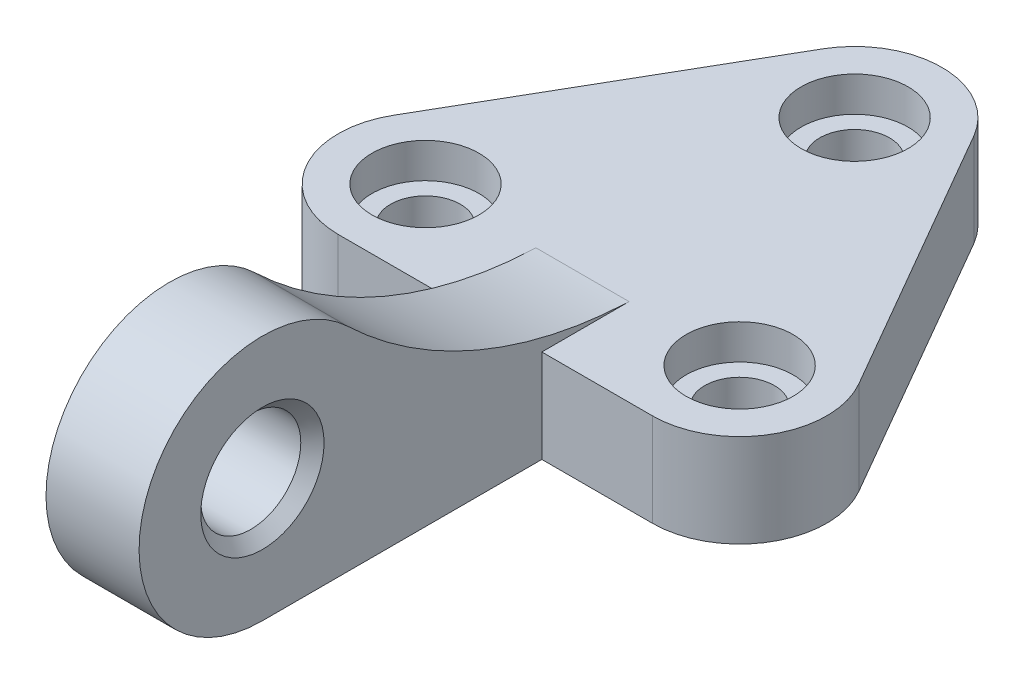
from build123d import *

# Parameters (mm, degrees)
BOSS_EXTRUDE1_DEPTH                             = 40
SKETCH4_R                                       = 23
CUT_EXTRUDE1_DEPTH                              = 15
BOSS_EXTRUDE3_DEPTH                             = 20
CSK_FOR_M2_OVAL_HEAD_MACHINE_SCREW1_D           = 43
CSK_FOR_M2_OVAL_HEAD_MACHINE_SCREW1_CSINK_D     = 53
CSK_FOR_M2_OVAL_HEAD_MACHINE_SCREW1_CSINK_ANGLE = 90
SKETCH18_W                                      = 15
SKETCH18_H                                      = 25
M2_CLEARANCE_HOLE1_AT_2_COUNT                   = 2
M2_CLEARANCE_HOLE1_AT_2_PITCH                   = 135
M2_CLEARANCE_HOLE1_AT_3_COUNT                   = 2
M2_CLEARANCE_HOLE1_AT_3_PITCH                   = 135


with BuildPart() as part:
    # Sketch1 → Boss-Extrude1 (new body)
    with BuildSketch(Plane(origin=(0, 0, 0), x_dir=(1, 0, 0), z_dir=(0, 1, 0))):
        with BuildLine():
            Line((64.951905284, 0), (199.951905284, 0))
            ThreePointArc((199.951905284, 0), (232.427857926, 18.75), (232.427857926, 56.25))
            Line((232.427857926, 56.25), (164.927857926, 173.163429511))
            ThreePointArc((164.927857926, 173.163429511), (132.451905284, 191.913429511), (99.975952642, 173.163429511))
            Line((99.975952642, 173.163429511), (32.475952642, 56.25))
            ThreePointArc((32.475952642, 56.25), (32.475952642, 18.75), (64.951905284, 0))
        make_face()
    extrude(amount=BOSS_EXTRUDE1_DEPTH)

    # Sketch4 → Cut-Extrude1 (cut)
    with BuildSketch(Plane(origin=(0, 40, 0), x_dir=(1, 0, 0), z_dir=(0, 1, 0))):
        with Locations(Location((64.951905284, 37.5, 0), (0, 0, 270))):
            Circle(SKETCH4_R)
        with Locations(Location((199.951905284, 37.5, 0), (0, 0, 270))):
            Circle(SKETCH4_R)
        with Locations(Location((132.451905284, 154.413429511, 0), (0, 0, 270))):
            Circle(SKETCH4_R)
    extrude(amount=-CUT_EXTRUDE1_DEPTH, mode=Mode.SUBTRACT)

    # Sketch16 → Boss-Extrude3 (add, symmetric)
    with BuildSketch(Plane(origin=(132.451905284, 0, 0), x_dir=(0, 0, -1), z_dir=(1, 0, 0))):
        with BuildLine():
            Line((-120.086570489, 0), (0, 0))
            Line((0, 0), (37.5, 0))
            Line((37.5, 0), (37.5, 40))
            ThreePointArc((37.5, 40), (-27.641071176, 54.533483722), (-83.385649061, 91.236662594))
            ThreePointArc((-83.385649061, 91.236662594), (-169.257411022, 72.779495475), (-120.086570489, 0))
        make_face()
    extrude(amount=BOSS_EXTRUDE3_DEPTH, both=True)

    # CSK for M2 Oval Head Machine Screw1 (through all)
    with Locations(Plane(origin=(152.451905284, 53, 120.086570489), x_dir=(0, 0, 1), z_dir=(1, 0, 0))):
        with Locations((0, 0)):
            CounterSinkHole(CSK_FOR_M2_OVAL_HEAD_MACHINE_SCREW1_D / 2, CSK_FOR_M2_OVAL_HEAD_MACHINE_SCREW1_CSINK_D / 2, counter_sink_angle=CSK_FOR_M2_OVAL_HEAD_MACHINE_SCREW1_CSINK_ANGLE)

    # Sketch18 → M2 Clearance Hole1 (revolve, cut)
    with BuildSketch(Plane(origin=(64.951905284, 25, -37.5), x_dir=(0, 0, 1), z_dir=(1, 0, 0))):
        with Locations((7.5, 12.5)):
            Rectangle(SKETCH18_W, SKETCH18_H)
    m2_clearance_hole1 = revolve(axis=Axis((64.951905284, 31.35, -37.5), (0, -1, 0)), mode=Mode.SUBTRACT)

    # M2 Clearance Hole1 at 2: M2 Clearance Hole1 ×2
    with Locations(*[(i * M2_CLEARANCE_HOLE1_AT_2_PITCH, 0, 0) for i in range(1, M2_CLEARANCE_HOLE1_AT_2_COUNT)]):
        add(m2_clearance_hole1, mode=Mode.SUBTRACT)

    # M2 Clearance Hole1 at 3: M2 Clearance Hole1 ×2
    with Locations(*[Vector(0.49999999999999206, 0, -0.8660254037844433) * (i * M2_CLEARANCE_HOLE1_AT_3_PITCH) for i in range(1, M2_CLEARANCE_HOLE1_AT_3_COUNT)]):
        add(m2_clearance_hole1, mode=Mode.SUBTRACT)


solid = part.part
